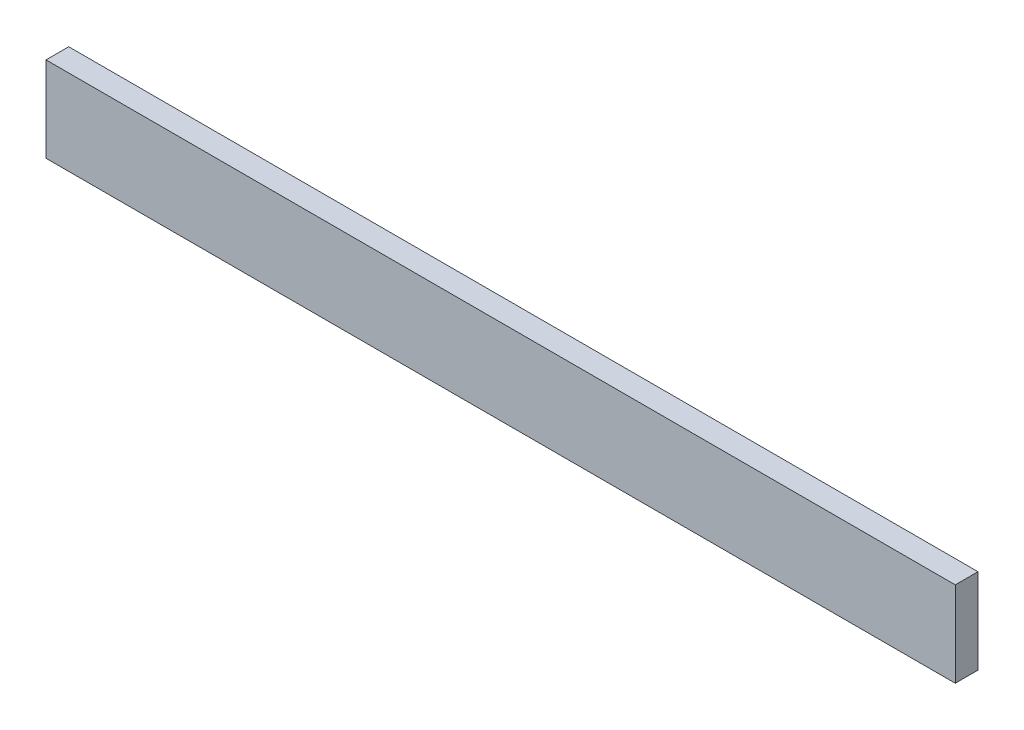
from build123d import *

# Parameters (mm, degrees)
SKETCH1_W      = 101.6
SKETCH1_H      = 9.525
EXTRUDE1_DEPTH = 2.54


with BuildPart() as part:
    # Sketch1 → Extrude1 (new body)
    with BuildSketch(Plane.XY):
        with Locations((0, 237.3824945)):
            Rectangle(SKETCH1_W, SKETCH1_H)
    extrude(amount=EXTRUDE1_DEPTH)


solid = part.part
